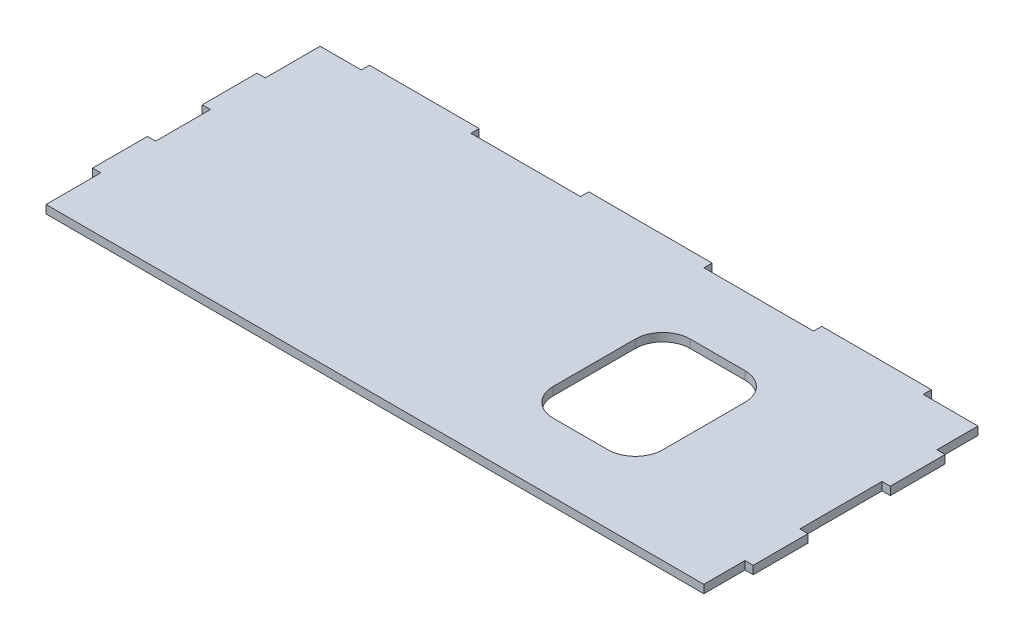
from build123d import *

# Parameters (mm, degrees)
BOSS_EXTRUDE1_DEPTH = 3
SKETCH2_W           = 40
SKETCH2_H           = 3
SKETCH2_W_2         = 45
BOSS_EXTRUDE2_DEPTH = 3
CUT_EXTRUDE1_DEPTH  = 3


with BuildPart() as part:
    # Sketch1 → Boss-Extrude1 (new body)
    with BuildSketch(Plane(origin=(0, 0, 0), x_dir=(1, 0, 0), z_dir=(0, 1, 0))):
        Polygon((-118.5, -30), (-118.5, -50), (121.5, -50), (121.5, -35), (124.5, -35), (124.5, -15), (121.5, -15), (121.5, 15), (124.5, 15), (124.5, 35), (121.5, 35), (121.5, 50), (-118.5, 50), (-118.5, 30), (-121.5, 30), (-121.5, 10), (-118.5, 10), (-118.5, -10), (-121.5, -10), (-121.5, -30), align=None)
    extrude(amount=BOSS_EXTRUDE1_DEPTH)

    # Sketch2 → Boss-Extrude2 (add)
    with BuildSketch(Plane(origin=(0, 0, -50), x_dir=(-1, 0, 0), z_dir=(0, 0, -1))):
        with Locations((-81.5, 1.5)):
            Rectangle(SKETCH2_W, SKETCH2_H)
        with Locations((1, 1.5)):
            Rectangle(SKETCH2_W_2, SKETCH2_H)
        with Locations((83.5, 1.5)):
            Rectangle(SKETCH2_W, SKETCH2_H)
    extrude(amount=BOSS_EXTRUDE2_DEPTH)

    # Sketch3 → Cut-Extrude1 (cut)
    with BuildSketch(Plane(origin=(0, 3, 0), x_dir=(1, 0, 0), z_dir=(0, 1, 0))):
        with BuildLine():
            Line((41.5, 25), (61.5, 25))
            ThreePointArc((61.5, 25), (68.571067812, 22.071067812), (71.5, 15))
            Line((71.5, 15), (71.5, -15))
            ThreePointArc((71.5, -15), (68.571067812, -22.071067812), (61.5, -25))
            Line((61.5, -25), (41.5, -25))
            ThreePointArc((41.5, -25), (34.428932188, -22.071067812), (31.5, -15))
            Line((31.5, -15), (31.5, 15))
            ThreePointArc((31.5, 15), (34.428932188, 22.071067812), (41.5, 25))
        make_face()
    extrude(amount=-CUT_EXTRUDE1_DEPTH, mode=Mode.SUBTRACT)


solid = part.part
